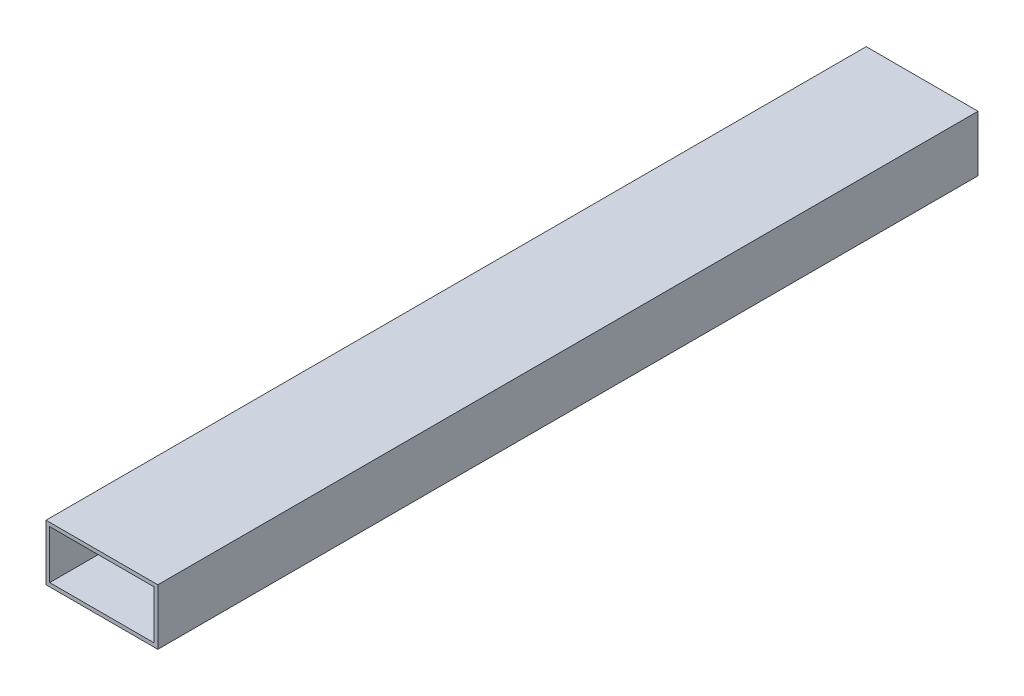
from build123d import *

# Parameters (mm, degrees)
SKETCH_1_W      = 30
SKETCH_1_H      = 15
SKETCH_1_W_2    = 28
SKETCH_1_H_2    = 13
EXTRUDE_1_DEPTH = 220


with BuildPart() as part:
    # 草图1 → 凸台-拉伸1 (new body)
    with BuildSketch(Plane.XY):
        with Locations((15, 7.5)):
            Rectangle(SKETCH_1_W, SKETCH_1_H)
        with Locations((15, 7.5)):
            Rectangle(SKETCH_1_W_2, SKETCH_1_H_2, mode=Mode.SUBTRACT)
    extrude(amount=EXTRUDE_1_DEPTH)


solid = part.part
